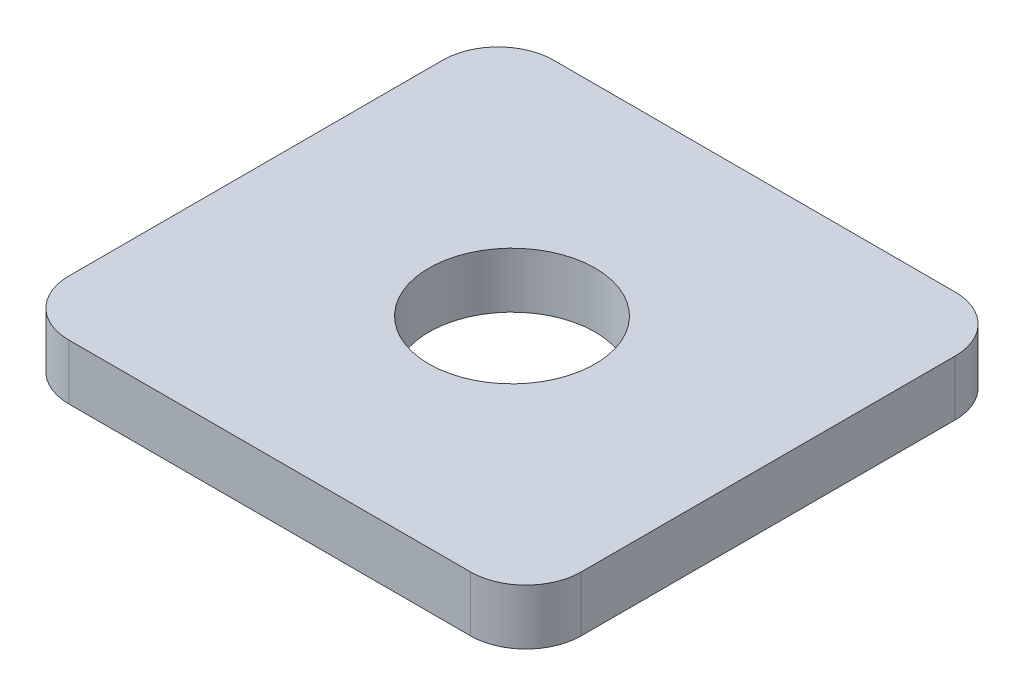
from build123d import *

# Parameters (mm, degrees)
SKETCH1_W           = 18.5
SKETCH1_H           = 17.5
BOSS_EXTRUDE1_DEPTH = 2
FILLET1_R           = 2
SKETCH4_R           = 3
CUT_EXTRUDE3_DEPTH  = 10


with BuildPart() as part:
    # Sketch1 → Boss-Extrude1 (new body)
    with BuildSketch(Plane(origin=(0, 0, 0), x_dir=(1, 0, 0), z_dir=(0, 1, 0))):
        Rectangle(SKETCH1_W, SKETCH1_H)
    extrude(amount=BOSS_EXTRUDE1_DEPTH)

    # Fillet1
    fillet1_edges = [part.edges().sort_by_distance(p)[0] for p in [
        (9.25, 1, 8.75),
        (-9.25, 1, 8.75),
        (-9.25, 1, -8.75),
        (9.25, 1, -8.75),
    ]]
    fillet(fillet1_edges, radius=FILLET1_R)

    # Sketch4 → Cut-Extrude3 (cut)
    with BuildSketch(Plane(origin=(0, 2, 0), x_dir=(1, 0, 0), z_dir=(0, 1, 0))):
        with Locations(Location((0, 0, 0), (0, 0, 270))):
            Circle(SKETCH4_R)
    extrude(amount=-CUT_EXTRUDE3_DEPTH, mode=Mode.SUBTRACT)


solid = part.part
